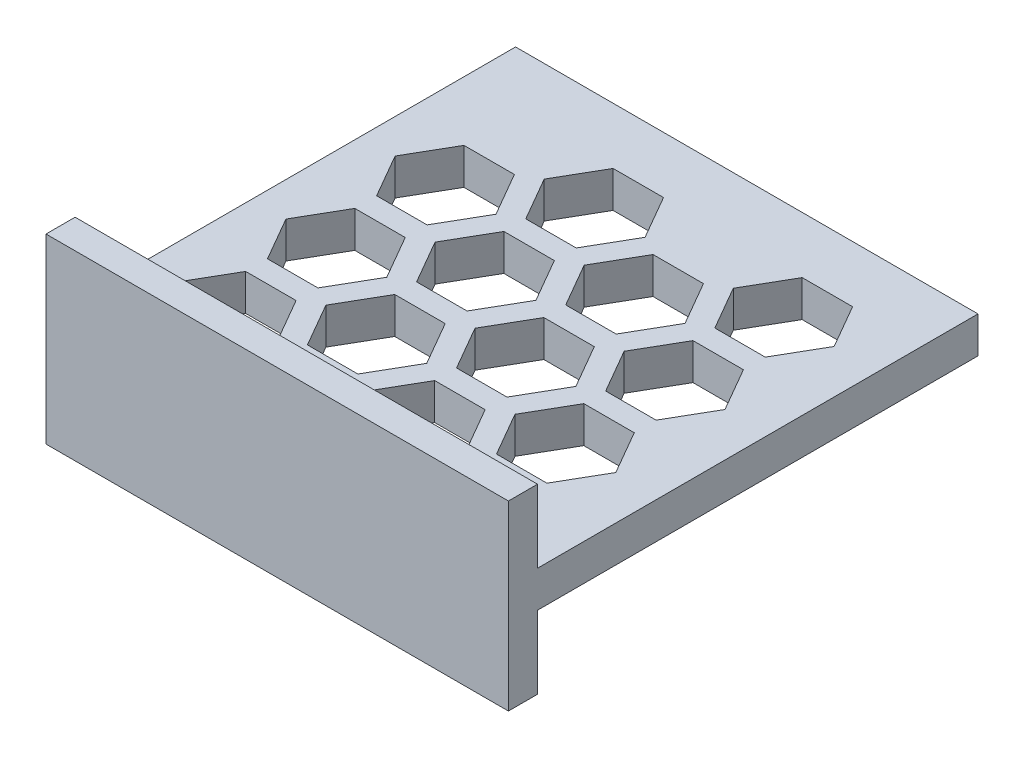
from build123d import *

# Parameters (mm, degrees)
SKETCH1_W           = 31.770430493
SKETCH1_H           = 30.262813536
BOSS_EXTRUDE1_DEPTH = 2.5
SKETCH2_W           = 31.770430493
SKETCH2_H           = 12.5
BOSS_EXTRUDE2_DEPTH = 2


with BuildPart() as part:
    # Sketch1 → Boss-Extrude1 (new body)
    with BuildSketch(Plane(origin=(0, 0, 0), x_dir=(1, 0, 0), z_dir=(0, 1, 0))):
        with Locations((15.885215247, 15.131406768)):
            Rectangle(SKETCH1_W, SKETCH1_H)
        Polygon((7.547843414, 7.63328856), (4.083741799, 7.63328856), (2.351690991, 4.63328856), (4.083741799, 1.63328856), (7.547843414, 1.63328856), (9.279894221, 4.63328856), align=None, mode=Mode.SUBTRACT)
        Polygon((14.043033942, 11.38328856), (10.578932327, 11.38328856), (8.846881519, 8.38328856), (10.578932327, 5.38328856), (14.043033942, 5.38328856), (15.77508475, 8.38328856), align=None, mode=Mode.SUBTRACT)
        Polygon((20.537843414, 7.63328856), (17.073741799, 7.63328856), (15.341690991, 4.63328856), (17.073741799, 1.63328856), (20.537843414, 1.63328856), (22.269894221, 4.63328856), align=None, mode=Mode.SUBTRACT)
        Polygon((27.033033942, 11.38328856), (23.568932327, 11.38328856), (21.836881519, 8.38328856), (23.568932327, 5.38328856), (27.033033942, 5.38328856), (28.76508475, 8.38328856), align=None, mode=Mode.SUBTRACT)
        Polygon((20.537843414, 15.13328856), (17.073741799, 15.13328856), (15.341690991, 12.13328856), (17.073741799, 9.13328856), (20.537843414, 9.13328856), (22.269894221, 12.13328856), align=None, mode=Mode.SUBTRACT)
        Polygon((27.033033942, 18.88328856), (23.568932327, 18.88328856), (21.836881519, 15.88328856), (23.568932327, 12.88328856), (27.033033942, 12.88328856), (28.76508475, 15.88328856), align=None, mode=Mode.SUBTRACT)
        Polygon((20.537843414, 22.63328856), (17.073741799, 22.63328856), (15.341690991, 19.63328856), (17.073741799, 16.63328856), (20.537843414, 16.63328856), (22.269894221, 19.63328856), align=None, mode=Mode.SUBTRACT)
        Polygon((27.033033942, 26.38328856), (23.568932327, 26.38328856), (21.836881519, 23.38328856), (23.568932327, 20.38328856), (27.033033942, 20.38328856), (28.76508475, 23.38328856), align=None, mode=Mode.SUBTRACT)
        Polygon((7.547843414, 15.13328856), (4.083741799, 15.13328856), (2.351690991, 12.13328856), (4.083741799, 9.13328856), (7.547843414, 9.13328856), (9.279894221, 12.13328856), align=None, mode=Mode.SUBTRACT)
        Polygon((14.043033942, 18.88328856), (10.578932327, 18.88328856), (8.846881519, 15.88328856), (10.578932327, 12.88328856), (14.043033942, 12.88328856), (15.77508475, 15.88328856), align=None, mode=Mode.SUBTRACT)
        Polygon((7.547843414, 22.63328856), (4.083741799, 22.63328856), (2.351690991, 19.63328856), (4.083741799, 16.63328856), (7.547843414, 16.63328856), (9.279894221, 19.63328856), align=None, mode=Mode.SUBTRACT)
        Polygon((14.043033942, 26.38328856), (10.578932327, 26.38328856), (8.846881519, 23.38328856), (10.578932327, 20.38328856), (14.043033942, 20.38328856), (15.77508475, 23.38328856), align=None, mode=Mode.SUBTRACT)
    extrude(amount=BOSS_EXTRUDE1_DEPTH)

    # Sketch2 → Boss-Extrude2 (add)
    with BuildSketch(Plane.XY):
        with Locations((15.885215247, 1.25)):
            Rectangle(SKETCH2_W, SKETCH2_H)
    extrude(amount=BOSS_EXTRUDE2_DEPTH)


solid = part.part
